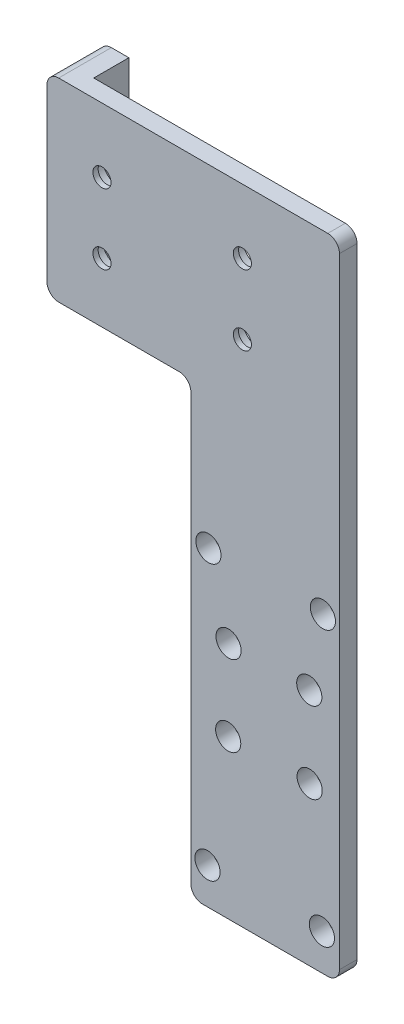
from build123d import *

# Parameters (mm, degrees)
BOSS_EXTRU_1_DEPTH                                 = 3
D_GAGEMENT_61_D                                    = 4.3053
CHAMBRAGE_POUR_VIS_T_TE_RONDE_BOMB_E_M_D           = 3.1
CHAMBRAGE_POUR_VIS_T_TE_RONDE_BOMB_E_M_CBORE_D     = 6
CHAMBRAGE_POUR_VIS_T_TE_RONDE_BOMB_E_M_CBORE_DEPTH = 2.1
ESQUISSE7_W                                        = 5
ESQUISSE7_H                                        = 20
BOSS_EXTRU_2_DEPTH                                 = 6
ENL_V_MAT_EXTRU_1_REACH                            = 117.583
ESQUISSE8_W                                        = 2
ESQUISSE8_H                                        = 6
ENL_V_MAT_EXTRU_2_REACH                            = 83.526
ESQUISSE9_W                                        = 6
ESQUISSE9_H                                        = 2
ENL_V_MAT_EXTRU_3_REACH                            = 122.973
ESQUISSE10_W                                       = 2
ESQUISSE10_H                                       = 6
CONG_1_R                                           = 2
D_GAGEMENT_65_D                                    = 4.3053
D_GAGEMENT_64_D                                    = 4.3053


with BuildPart() as part:
    # Esquisse1 → Boss.-Extru.1 (new body)
    with BuildSketch(Plane.XY):
        Polygon((0, 0), (26.638249305, 0), (26.638249305, -109.993030409), (1.238249305, -109.993030409), (1.238249305, -33.176189805), (-23.361750695, -33.176189805), (-23.361750695, 0), align=None)
    extrude(amount=BOSS_EXTRU_1_DEPTH)

    # Dégagement #61 (through all)
    with Locations(Plane.XY.offset(3)):
        with Locations((21.47630139, -69.193030409), (7.67630139, -69.193030409), (7.617175732, -82.993030409), (21.538249305, -82.993030409)):
            Hole(D_GAGEMENT_61_D / 2)

    # Chambrage pour vis à tête ronde bombée M2.51 (through all)
    with Locations(Plane(origin=(0, 0, 0), x_dir=(-1, 0, 0), z_dir=(0, 0, -1))):
        with Locations((13.961750695, -23), (13.961750695, -11), (-10.038249305, -11), (-10.038249305, -23)):
            CounterBoreHole(CHAMBRAGE_POUR_VIS_T_TE_RONDE_BOMB_E_M_D / 2, CHAMBRAGE_POUR_VIS_T_TE_RONDE_BOMB_E_M_CBORE_D / 2, CHAMBRAGE_POUR_VIS_T_TE_RONDE_BOMB_E_M_CBORE_DEPTH)

    # Esquisse7 → Boss.-Extru.2 (add)
    with BuildSketch(Plane(origin=(0, 0, 0), x_dir=(-1, 0, 0), z_dir=(0, 0, -1))):
        Polygon((-11.638249305, -63.176189805), (-11.638249305, -33.176189805), (23.361750695, -33.176189805), (23.361750695, 0), (18.361750695, 0), (18.361750695, -28.176189805), (-16.638249305, -28.176189805), (-16.638249305, -63.176189805), align=None)
        with Locations((-14.138249305, -99.993030409)):
            Rectangle(ESQUISSE7_W, ESQUISSE7_H)
    extrude(amount=BOSS_EXTRU_2_DEPTH)

    # Esquisse8 → Enlèv. mat.-Extru.1 (cut, up to next)
    with BuildSketch(Plane.ZY.offset(-11.638249305), mode=Mode.PRIVATE) as enl_v_mat_extru_1_sk1:
        with Locations((-3, -49.176189805)):
            Rectangle(ESQUISSE8_W, ESQUISSE8_H)
    enl_v_mat_extru_1_tool1 = extrude(enl_v_mat_extru_1_sk1.sketch, amount=-ENL_V_MAT_EXTRU_1_REACH, mode=Mode.PRIVATE) & part.part
    add(enl_v_mat_extru_1_tool1.solids().sort_by_distance((11.638249, -49.17619, -3))[0], mode=Mode.SUBTRACT)

    # Esquisse9 → Enlèv. mat.-Extru.2 (cut, up to next)
    with BuildSketch(Plane.XZ.offset(33.176189805), mode=Mode.PRIVATE) as enl_v_mat_extru_2_sk1:
        with Locations((-3.361750695, -3)):
            Rectangle(ESQUISSE9_W, ESQUISSE9_H)
    enl_v_mat_extru_2_tool1 = extrude(enl_v_mat_extru_2_sk1.sketch, amount=-ENL_V_MAT_EXTRU_2_REACH, mode=Mode.PRIVATE) & part.part
    add(enl_v_mat_extru_2_tool1.solids().sort_by_distance((-3.361751, -33.17619, -3))[0], mode=Mode.SUBTRACT)

    # Esquisse10 → Enlèv. mat.-Extru.3 (cut, up to next)
    with BuildSketch(Plane.ZY.offset(23.361750695), mode=Mode.PRIVATE) as enl_v_mat_extru_3_sk1:
        with Locations((-3, -15.176189805)):
            Rectangle(ESQUISSE10_W, ESQUISSE10_H)
    enl_v_mat_extru_3_tool1 = extrude(enl_v_mat_extru_3_sk1.sketch, amount=-ENL_V_MAT_EXTRU_3_REACH, mode=Mode.PRIVATE) & part.part
    add(enl_v_mat_extru_3_tool1.solids().sort_by_distance((-23.361751, -15.17619, -3))[0], mode=Mode.SUBTRACT)

    # Congé1
    cong_1_edges = [part.edges().sort_by_distance(p)[0] for p in [
        (26.638249305, 0, 1.5),
        (26.638249305, -109.993030409, 1.5),
        (1.238249305, -109.993030409, 1.5),
        (1.238249305, -33.176189805, 1.5),
        (-23.361750695, -33.176189805, -1.5),
        (-23.361750695, 0, -1.5),
        (-18.361750695, -28.176189805, -3),
        (16.638249305, -28.176189805, -3),
        (11.638249305, -33.176189805, -3),
    ]]
    fillet(cong_1_edges, radius=CONG_1_R)

    # Dégagement #65 (through all)
    with Locations(Plane(origin=(0, 0, 0), x_dir=(-1, 0, 0), z_dir=(0, 0, -1))):
        with Locations((-23.638249305, -103.793030409), (-4.078249305, -103.793030409)):
            Hole(D_GAGEMENT_65_D / 2)

    # Dégagement #64 (through all)
    with Locations(Plane(origin=(0, 0, 0), x_dir=(-1, 0, 0), z_dir=(0, 0, -1))):
        with Locations((-23.798249305, -56.793030409), (-4.238249305, -56.793030409)):
            Hole(D_GAGEMENT_64_D / 2)


solid = part.part
